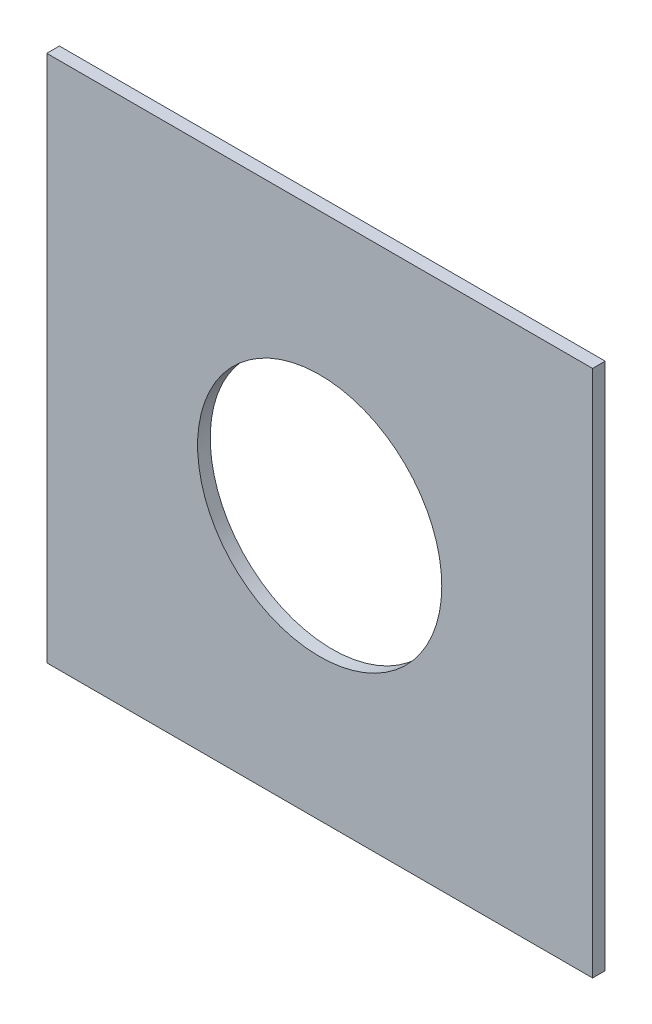
from build123d import *

# Parameters (mm, degrees)
SKETCH1_W           = 241.3
SKETCH1_H           = 233.3760128
BOSS_EXTRUDE1_DEPTH = 5.588
SKETCH2_R           = 53.975
CUT_EXTRUDE1_DEPTH  = 168.939688822


with BuildPart() as part:
    # Sketch1 → Boss-Extrude1 (new body)
    with BuildSketch(Plane.XY):
        Rectangle(SKETCH1_W, SKETCH1_H)
    extrude(amount=BOSS_EXTRUDE1_DEPTH)

    # Sketch2 → Cut-Extrude1 (cut, through all)
    with BuildSketch(Plane.XY.offset(5.588)):
        Circle(SKETCH2_R)
    extrude(amount=-CUT_EXTRUDE1_DEPTH, mode=Mode.SUBTRACT)


solid = part.part
